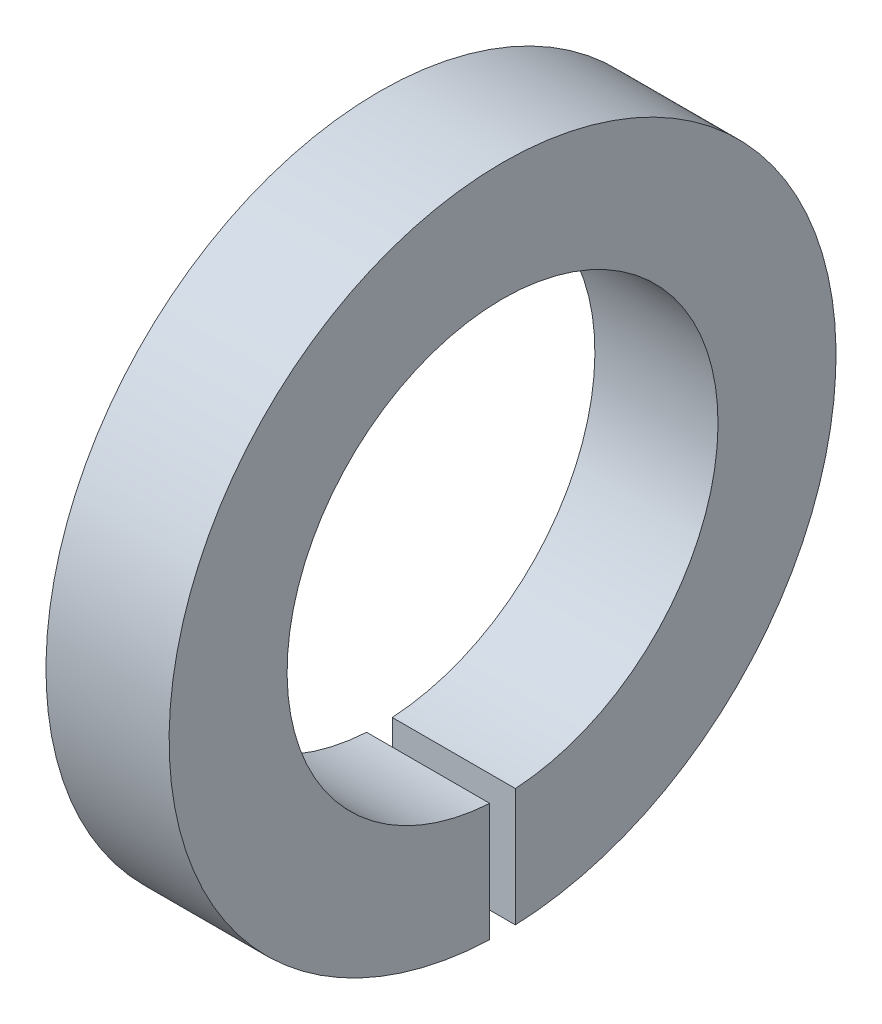
from build123d import *

# Parameters (mm, degrees)
SKETCH1_R          = 3.25
SKETCH1_R_2        = 2.1
BASE_EXTRUDE_DEPTH = 1.2
SLIT_BEND_DEPTH    = 5.750263151


with BuildPart() as part:
    # Sketch1 → Base-Extrude (new body)
    with BuildSketch(Plane(origin=(0, 0, 0), x_dir=(0, 0, -1), z_dir=(1, 0, 0))):
        Circle(SKETCH1_R)
        Circle(SKETCH1_R_2, mode=Mode.SUBTRACT)
    extrude(amount=BASE_EXTRUDE_DEPTH)

    # Sketch2 → Slit-bend (cut, through all)
    with BuildSketch(Plane(origin=(0, 0, 0), x_dir=(0, 0, -1), z_dir=(1, 0, 0))):
        with BuildLine():
            Line((-0.125, -2.096276461), (-0.125, -3.247595264))
            ThreePointArc((-0.125, -3.247595264), (0, -3.25), (0.125, -3.247595264))
            Line((0.125, -3.247595264), (0.125, -2.096276461))
            ThreePointArc((0.125, -2.096276461), (0, -2.1), (-0.125, -2.096276461))
        make_face()
    extrude(amount=SLIT_BEND_DEPTH, mode=Mode.SUBTRACT)


solid = part.part
